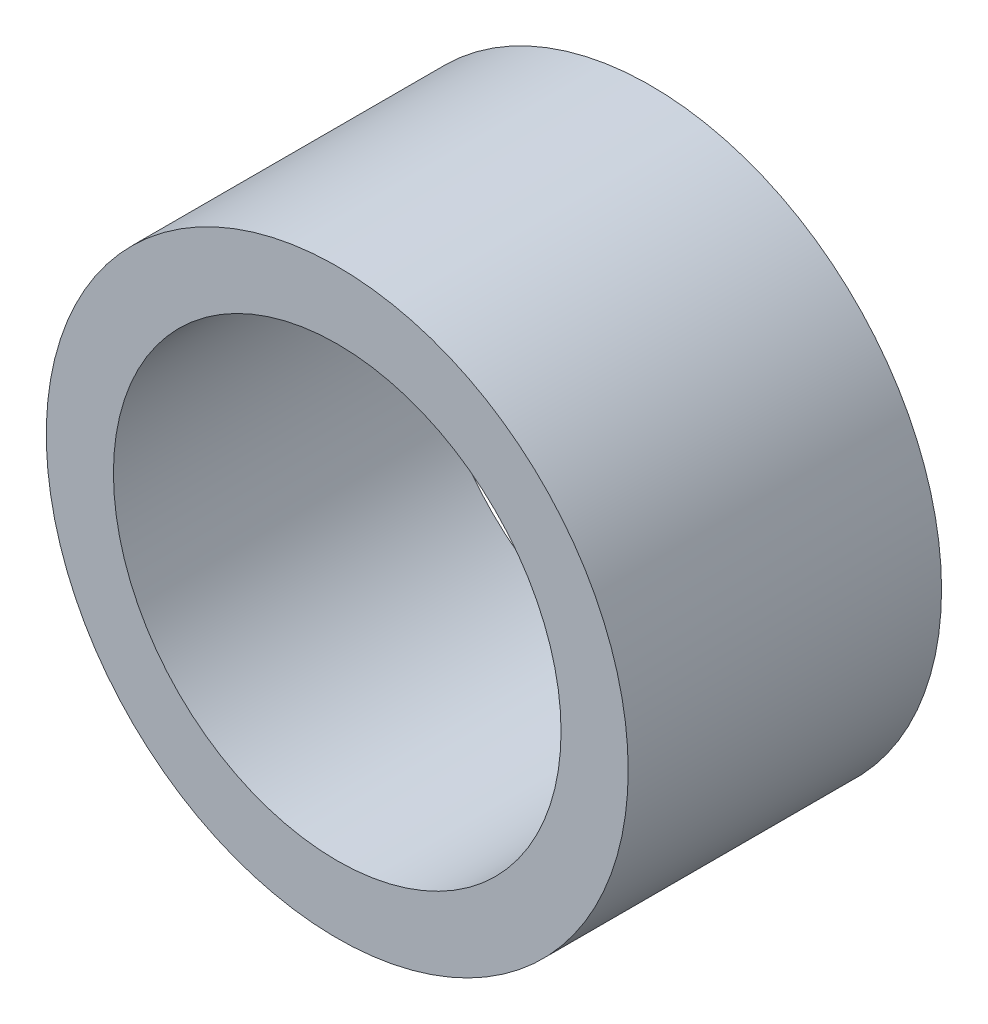
from build123d import *

# Parameters (mm, degrees)
SKETCH_1_R      = 6.5
SKETCH_1_R_2    = 5
EXTRUDE_1_DEPTH = 7


with BuildPart() as part:
    # 草图1 → 凸台-拉伸1 (new body)
    with BuildSketch(Plane.XY):
        Circle(SKETCH_1_R)
        Circle(SKETCH_1_R_2, mode=Mode.SUBTRACT)
    extrude(amount=EXTRUDE_1_DEPTH)


solid = part.part
